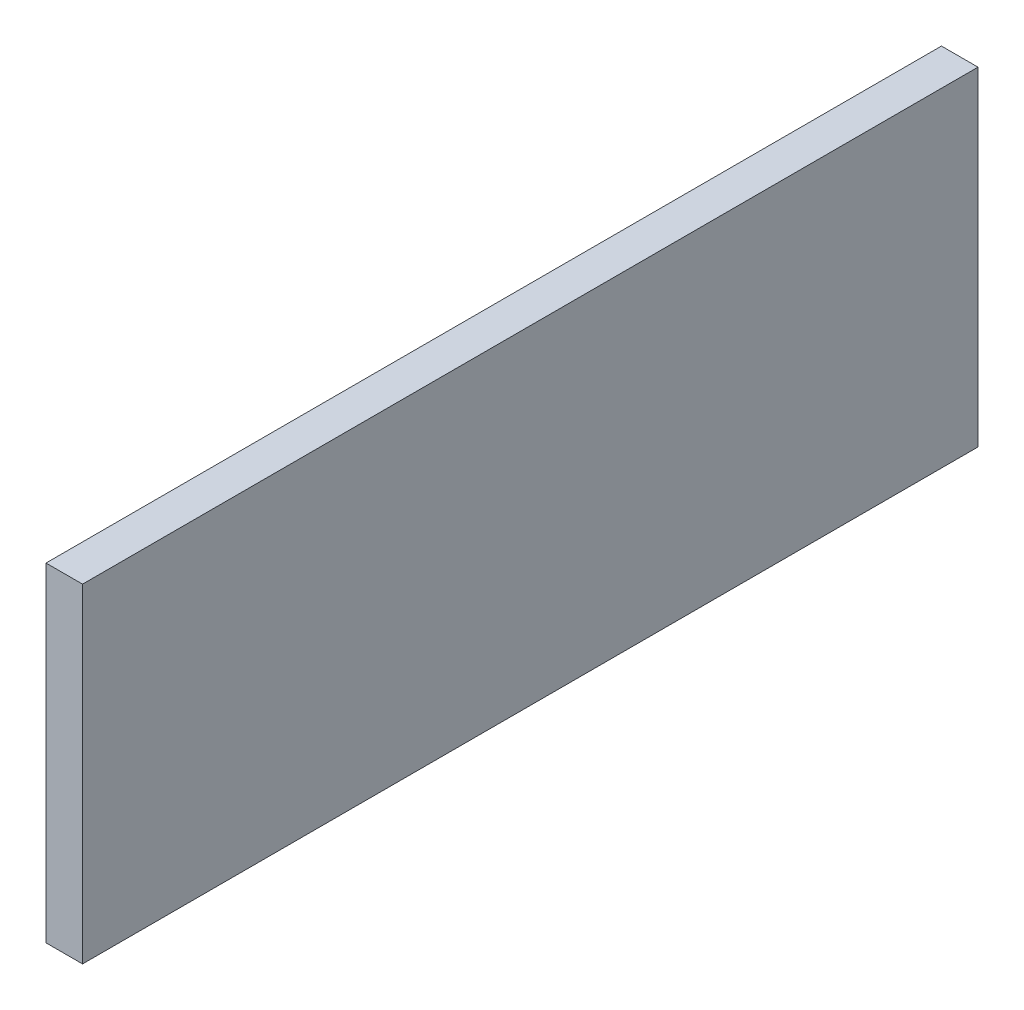
from build123d import *

# Parameters (mm, degrees)
SKETCH1_W           = 311.15
SKETCH1_H           = 114.3
BOSS_EXTRUDE1_DEPTH = 12.7


with BuildPart() as part:
    # Sketch1 → Boss-Extrude1 (new body)
    with BuildSketch(Plane(origin=(0, 0, 0), x_dir=(0, 0, -1), z_dir=(1, 0, 0))):
        with Locations((155.575, 57.15)):
            Rectangle(SKETCH1_W, SKETCH1_H)
    extrude(amount=BOSS_EXTRUDE1_DEPTH)


solid = part.part
